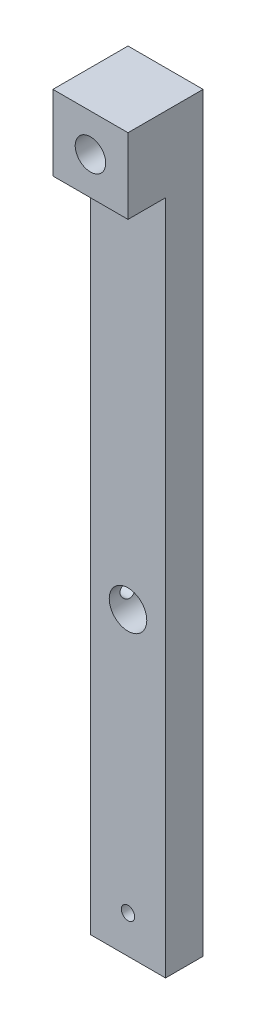
from build123d import *

# Parameters (mm, degrees)
SKETCH1_W                 = 12.7
SKETCH1_H                 = 127
BOSS_EXTRUDE1_DEPTH       = 6.35
SKETCH3_W                 = 12.7
SKETCH3_H                 = 12.7
BOSS_EXTRUDE2_DEPTH       = 6.35
SKETCH4_R                 = 3.175
CUT_EXTRUDE1_DEPTH        = 66.068137364
F_4_40_TAPPED_HOLE1_D     = 2.2606
SKETCH6_OUTSIDE_W         = 40.352
SKETCH6_OUTSIDE_H         = 154.652
SKETCH6_OUTSIDE_R         = 330.2
SKETCH6_OUTSIDE_R_2       = 2.5796875
CUT_EXTRUDE3_DEPTH        = 66.068137364
F_6_32_TAPPED_HOLE1_D     = 2.7051
F_6_32_TAPPED_HOLE1_DEPTH = 6.349
F_6_32_TAPPED_HOLE1_TIP   = 0.81269403


with BuildPart() as part:
    # Sketch1 → Boss-Extrude1 (new body)
    with BuildSketch(Plane.XY):
        Rectangle(SKETCH1_W, SKETCH1_H)
    extrude(amount=BOSS_EXTRUDE1_DEPTH)

    # Sketch3 → Boss-Extrude2 (add)
    with BuildSketch(Plane.XY.offset(6.35)):
        with Locations((0, 57.15)):
            Rectangle(SKETCH3_W, SKETCH3_H)
    extrude(amount=BOSS_EXTRUDE2_DEPTH)

    # Sketch4 → Cut-Extrude1 (cut, through all)
    with BuildSketch(Plane(origin=(0, 0, 0), x_dir=(-1, 0, 0), z_dir=(0, 0, -1))):
        with Locations((0, -12.7)):
            Circle(SKETCH4_R)
    extrude(amount=-CUT_EXTRUDE1_DEPTH, mode=Mode.SUBTRACT)

    # #4-40 Tapped Hole1 (through all)
    with Locations(Plane(origin=(0, -57.15, 0), x_dir=(-1, 0, 0), z_dir=(0, 0, -1))):
        with Locations((0, 0)):
            Hole(F_4_40_TAPPED_HOLE1_D / 2)

    # Sketch6 outside → Cut-Extrude3 (cut, through all)
    # profile 1 of 2: a face of its own
    with BuildSketch(Plane.XY.offset(12.7)):
        Rectangle(SKETCH6_OUTSIDE_W, SKETCH6_OUTSIDE_H)
        with Locations((0, 57.15)):
            Circle(SKETCH6_OUTSIDE_R, mode=Mode.SUBTRACT)
    # profile 2 of 2: a face of its own
    with BuildSketch(Plane.XY.offset(12.7)):
        with Locations((0, 57.15)):
            Circle(SKETCH6_OUTSIDE_R_2)
    extrude(amount=-CUT_EXTRUDE3_DEPTH, mode=Mode.SUBTRACT)

    # #6-32 Tapped Hole1
    with Locations(Plane.ZY.offset(6.35)):
        with Locations((3.175, -12.7)):
            Hole(F_6_32_TAPPED_HOLE1_D / 2, depth=F_6_32_TAPPED_HOLE1_DEPTH)
            with Locations((0, 0, -(F_6_32_TAPPED_HOLE1_DEPTH + F_6_32_TAPPED_HOLE1_TIP / 2))):  # 118° drill point
                Cone(0, F_6_32_TAPPED_HOLE1_D / 2, F_6_32_TAPPED_HOLE1_TIP, mode=Mode.SUBTRACT)


solid = part.part
